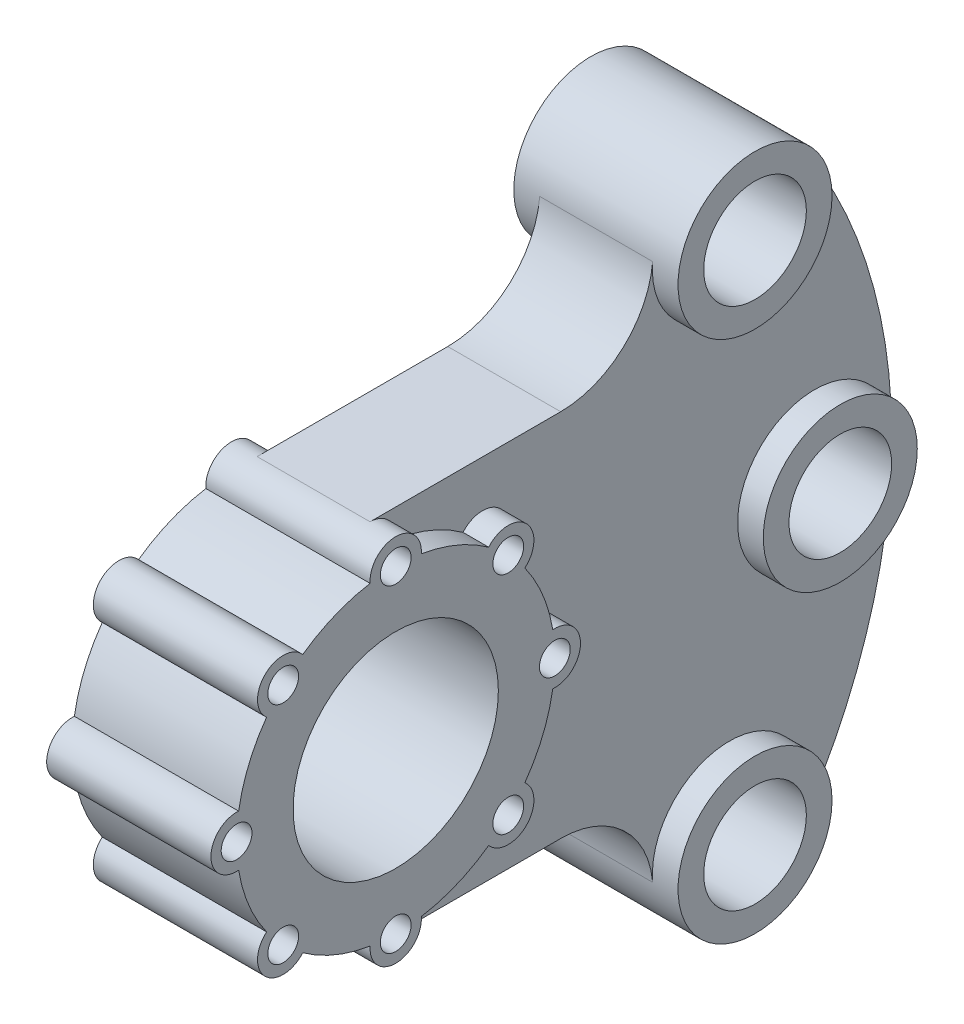
from build123d import *

# Parameters (mm, degrees)
SKETCH1_R            = 3
SKETCH1_R_2          = 20
BOSS_EXTRUDE2_DEPTH  = 16
SKETCH1_9_R          = 10
BOSS_EXTRUDE13_DEPTH = 11
SKETCH5_R            = 15
SKETCH5_R_2          = 10
BOSS_EXTRUDE14_DEPTH = 16


with BuildPart() as part:
    # Sketch1 → Boss-Extrude2 (new, symmetric)
    with BuildSketch(Plane.YZ):
        with BuildLine():
            ThreePointArc((-30.596774194, 4.983714373), (-34.389975735, 3.675331892), (-36, 0))
            ThreePointArc((-36, 0), (-34.389975735, -3.675331892), (-30.596774194, -4.983714373))
            ThreePointArc((-30.596774194, -4.983714373), (-28.640265508, -11.863186403), (-25.159204743, -18.111168286))
            ThreePointArc((-25.159204743, -18.111168286), (-25.455844123, -25.455844123), (-18.111168286, -25.159204743))
            ThreePointArc((-18.111168286, -25.159204743), (-11.863186403, -28.640265508), (-4.983714373, -30.596774194))
            ThreePointArc((-4.983714373, -30.596774194), (0, -36), (4.983714373, -30.596774194))
            ThreePointArc((4.983714373, -30.596774194), (11.863186403, -28.640265508), (18.111168286, -25.159204743))
            ThreePointArc((18.111168286, -25.159204743), (25.455844123, -25.455844123), (25.159204743, -18.111168286))
            ThreePointArc((25.159204743, -18.111168286), (28.640265508, -11.863186403), (30.596774194, -4.983714373))
            ThreePointArc((30.596774194, -4.983714373), (34.389975735, -3.675331892), (36, 0))
            ThreePointArc((36, 0), (34.389975735, 3.675331892), (30.596774194, 4.983714373))
            ThreePointArc((30.596774194, 4.983714373), (28.640265508, 11.863186403), (25.159204743, 18.111168286))
            ThreePointArc((25.159204743, 18.111168286), (25.455844123, 25.455844123), (18.111168286, 25.159204743))
            ThreePointArc((18.111168286, 25.159204743), (11.863186403, 28.640265508), (4.983714373, 30.596774194))
            ThreePointArc((4.983714373, 30.596774194), (0, 36), (-4.983714373, 30.596774194))
            ThreePointArc((-4.983714373, 30.596774194), (-11.863186403, 28.640265508), (-18.111168286, 25.159204743))
            ThreePointArc((-18.111168286, 25.159204743), (-25.455844123, 25.455844123), (-25.159204743, 18.111168286))
            ThreePointArc((-25.159204743, 18.111168286), (-28.640265508, 11.863186403), (-30.596774194, 4.983714373))
        make_face()
        with Locations((-21.920310217, -21.920310217)):
            Circle(SKETCH1_R, mode=Mode.SUBTRACT)
        with Locations((0, -31)):
            Circle(SKETCH1_R, mode=Mode.SUBTRACT)
        with Locations((-31, 0)):
            Circle(SKETCH1_R, mode=Mode.SUBTRACT)
        Circle(SKETCH1_R_2, mode=Mode.SUBTRACT)
        with Locations((-21.920310217, 21.920310217)):
            Circle(SKETCH1_R, mode=Mode.SUBTRACT)
        with Locations((0, 31)):
            Circle(SKETCH1_R, mode=Mode.SUBTRACT)
        with Locations((21.920310217, -21.920310217)):
            Circle(SKETCH1_R, mode=Mode.SUBTRACT)
        with Locations((31, 0)):
            Circle(SKETCH1_R, mode=Mode.SUBTRACT)
        with Locations((21.920310217, 21.920310217)):
            Circle(SKETCH1_R, mode=Mode.SUBTRACT)
    extrude(amount=BOSS_EXTRUDE2_DEPTH, both=True)

    # Sketch1<9> → Boss-Extrude13 (add, symmetric)
    with BuildSketch(Plane.YZ):
        with BuildLine():
            ThreePointArc((-30.596774194, -4.983714373), (-34.389975735, -3.675331892), (-36, 0))
            Line((-36, 0), (-36, -37.13664655))
            ThreePointArc((-36, -37.13664655), (-40.706118974, -49.272244074), (-52.363636364, -55.062112068))
            ThreePointArc((-52.363636364, -55.062112068), (-65.459339822, -66.009073802), (-59.83287028, -82.123547443))
            ThreePointArc((-59.83287028, -82.123547443), (0, -101.608313689), (59.83287028, -82.123547443))
            ThreePointArc((59.83287028, -82.123547443), (65.459339822, -66.009073802), (52.363636364, -55.062112068))
            ThreePointArc((52.363636364, -55.062112068), (40.706118974, -49.272244074), (36, -37.13664655))
            Line((36, -37.13664655), (36, 0))
            ThreePointArc((36, 0), (34.389975735, -3.675331892), (30.596774194, -4.983714373))
            ThreePointArc((30.596774194, -4.983714373), (28.640265508, -11.863186403), (25.159204743, -18.111168286))
            ThreePointArc((25.159204743, -18.111168286), (25.455844123, -25.455844123), (18.111168286, -25.159204743))
            ThreePointArc((18.111168286, -25.159204743), (11.863186403, -28.640265508), (4.983714373, -30.596774194))
            ThreePointArc((4.983714373, -30.596774194), (0, -36), (-4.983714373, -30.596774194))
            ThreePointArc((-4.983714373, -30.596774194), (-11.863186403, -28.640265508), (-18.111168286, -25.159204743))
            ThreePointArc((-18.111168286, -25.159204743), (-25.455844123, -25.455844123), (-25.159204743, -18.111168286))
            ThreePointArc((-25.159204743, -18.111168286), (-28.640265508, -11.863186403), (-30.596774194, -4.983714373))
        make_face()
        with Locations((-51, -70)):
            Circle(SKETCH1_9_R, mode=Mode.SUBTRACT)
        with Locations((0, -86.608313689)):
            Circle(SKETCH1_9_R, mode=Mode.SUBTRACT)
        with Locations((51, -70)):
            Circle(SKETCH1_9_R, mode=Mode.SUBTRACT)
    extrude(amount=BOSS_EXTRUDE13_DEPTH, both=True)

    # Sketch5 → Boss-Extrude14 (add, symmetric)
    # profile 1 of 3: a face of its own
    with BuildSketch(Plane.YZ):
        with Locations((0, -86.608313689)):
            Circle(SKETCH5_R)
        with Locations((0, -86.608313689)):
            Circle(SKETCH5_R_2, mode=Mode.SUBTRACT)
    # profile 2 of 3: a face of its own
    with BuildSketch(Plane.YZ):
        with Locations((-51, -70)):
            Circle(SKETCH5_R)
        with Locations((-51, -70)):
            Circle(SKETCH5_R_2, mode=Mode.SUBTRACT)
    # profile 3 of 3: a face of its own
    with BuildSketch(Plane.YZ):
        with Locations((51, -70)):
            Circle(SKETCH5_R)
        with Locations((51, -70)):
            Circle(SKETCH5_R_2, mode=Mode.SUBTRACT)
    extrude(amount=BOSS_EXTRUDE14_DEPTH, both=True)


solid = part.part
